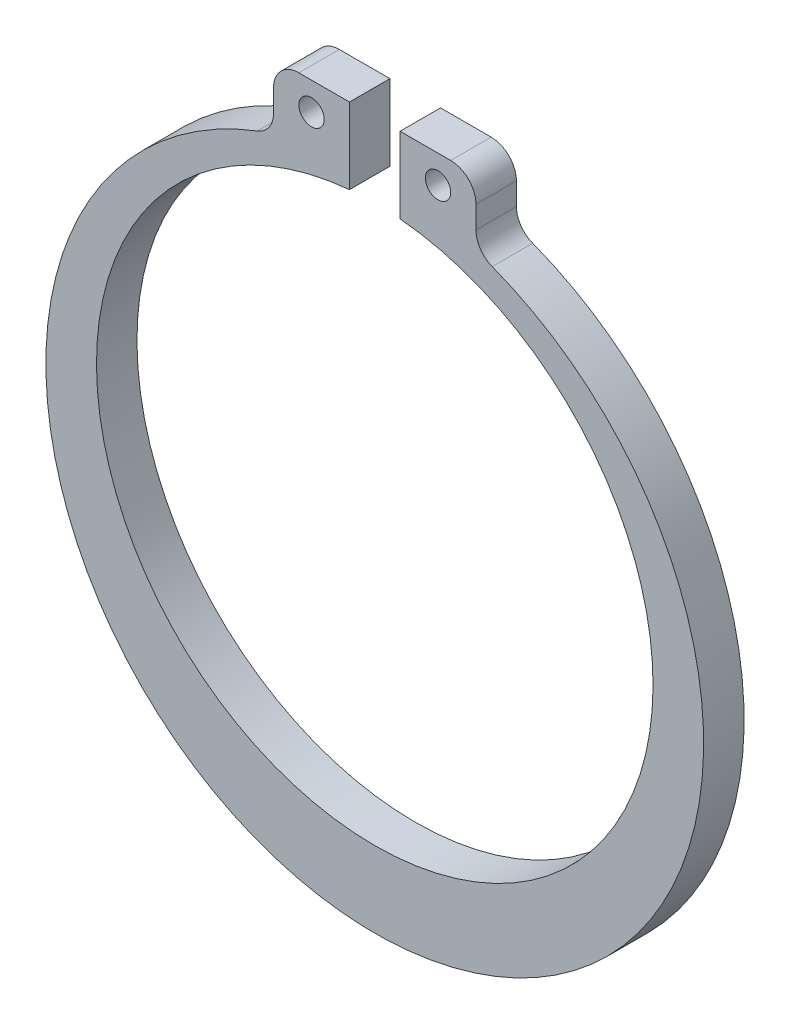
from build123d import *

# Parameters (mm, degrees)
SKETCH_1_R             = 0.25
EXTRUDE_1_DEPTH        = 0.4
FILLET_1_R             = 0.5
FILLET_1_OF_MIRROR_1_R = 0.5


with BuildPart() as part:
    # Эскиз1 → Бобышка-Вытянуть1 (new, symmetric)
    # profile 1 of 2: a face of its own
    with BuildSketch(Plane.XY):
        with BuildLine():
            Line((2, 6.977225575), (0.5, 6.977225575))
            Line((0.5, 6.977225575), (0.5, 5.980740698))
            ThreePointArc((0.5, 5.980740698), (1.258735944, 5.876957254), (2, 5.684658438))
            Line((2, 5.684658438), (2, 6.977225575))
        make_face()
        with Locations((1.25, 6.427950493)):
            Circle(SKETCH_1_R, mode=Mode.SUBTRACT)
    # profile 2 of 2: a face of its own
    with BuildSketch(Plane.XY):
        with BuildLine():
            ThreePointArc((2, 5.684658438), (1.258735944, 5.876957254), (0.5, 5.980740698))
            Line((0.5, 5.980740698), (0.5, 5.477225575))
            ThreePointArc((0.5, 5.477225575), (5.494303444, -0.250259203), (0, -5.5))
            Line((0, -5.5), (0, -7))
            ThreePointArc((0, -7), (6.420680643, -1.51235373), (2, 5.684658438))
        make_face()
    extrude_1 = extrude(amount=EXTRUDE_1_DEPTH, both=True)

    # Скругление1
    fillet_1_edges = [part.edges().sort_by_distance(p)[0] for p in [
        (2, 6.977225575, 0),
        (2, 5.684658438, 0),
    ]]
    fillet(fillet_1_edges, radius=FILLET_1_R)

    # Зеркальное отражение1: Бобышка-Вытянуть1 across plane
    add(extrude_1.mirror(Plane(origin=(0, 0, 0.4), x_dir=(0, 0, 1), z_dir=(1, 0, 0))))

    # Скругление1 of Зеркальное отражение1
    fillet_1_of_mirror_1_edges = [part.edges().sort_by_distance(p)[0] for p in [
        (-2, 6.977225575, 0),
        (-2, 5.684658438, 0),
    ]]
    fillet(fillet_1_of_mirror_1_edges, radius=FILLET_1_OF_MIRROR_1_R)


solid = part.part
